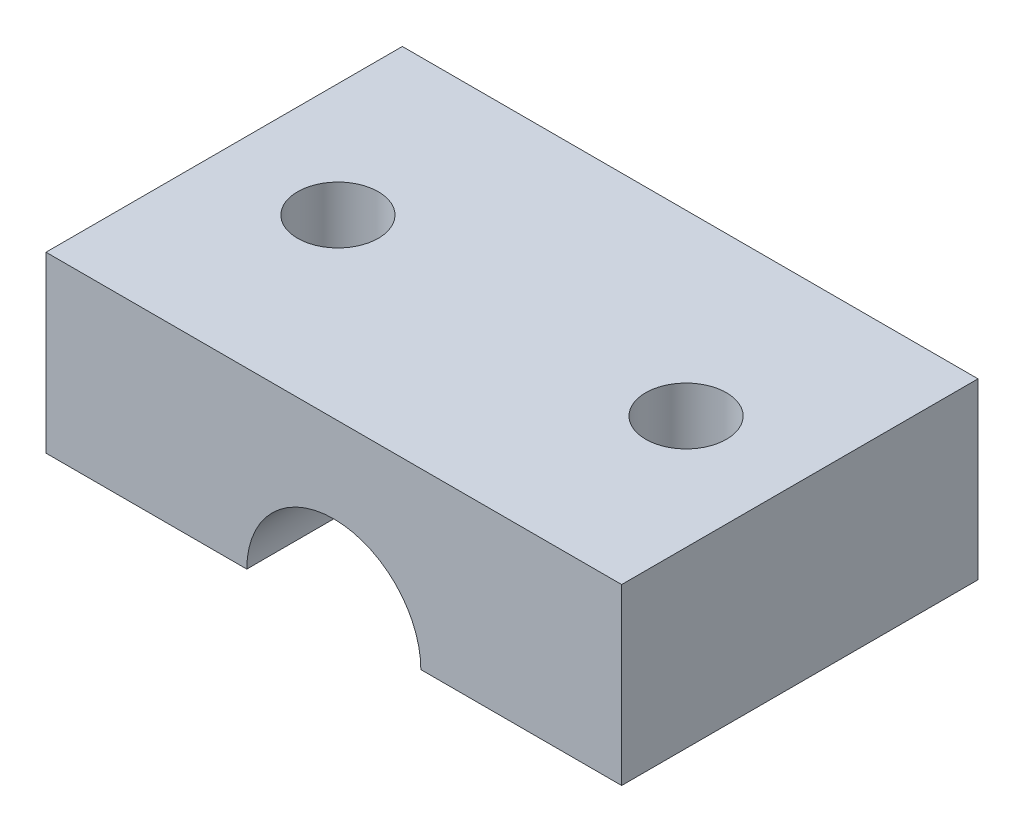
from build123d import *

# Parameters (mm, degrees)
SKETCH1_W           = 21
SKETCH1_H           = 13
SKETCH1_R           = 1.4732
BOSS_EXTRUDE1_DEPTH = 6.35
SKETCH2_R           = 3.175
CUT_EXTRUDE1_DEPTH  = 13


with BuildPart() as part:
    # Sketch1 → Boss-Extrude1 (new body)
    with BuildSketch(Plane(origin=(0, 0, 0), x_dir=(1, 0, 0), z_dir=(0, 1, 0))):
        with Locations((20.5, -6.5)):
            Rectangle(SKETCH1_W, SKETCH1_H)
        with Locations(Location((14.15, -6.5, 0), (0, 0, 270))):
            Circle(SKETCH1_R, mode=Mode.SUBTRACT)
        with Locations(Location((26.85, -6.5, 0), (0, 0, 270))):
            Circle(SKETCH1_R, mode=Mode.SUBTRACT)
    extrude(amount=BOSS_EXTRUDE1_DEPTH)

    # Sketch2 → Cut-Extrude1 (cut)
    with BuildSketch(Plane(origin=(0, 0, 0), x_dir=(-1, 0, 0), z_dir=(0, 0, -1))):
        with Locations((-20.5, 0)):
            Circle(SKETCH2_R)
    extrude(amount=-CUT_EXTRUDE1_DEPTH, mode=Mode.SUBTRACT)


solid = part.part
